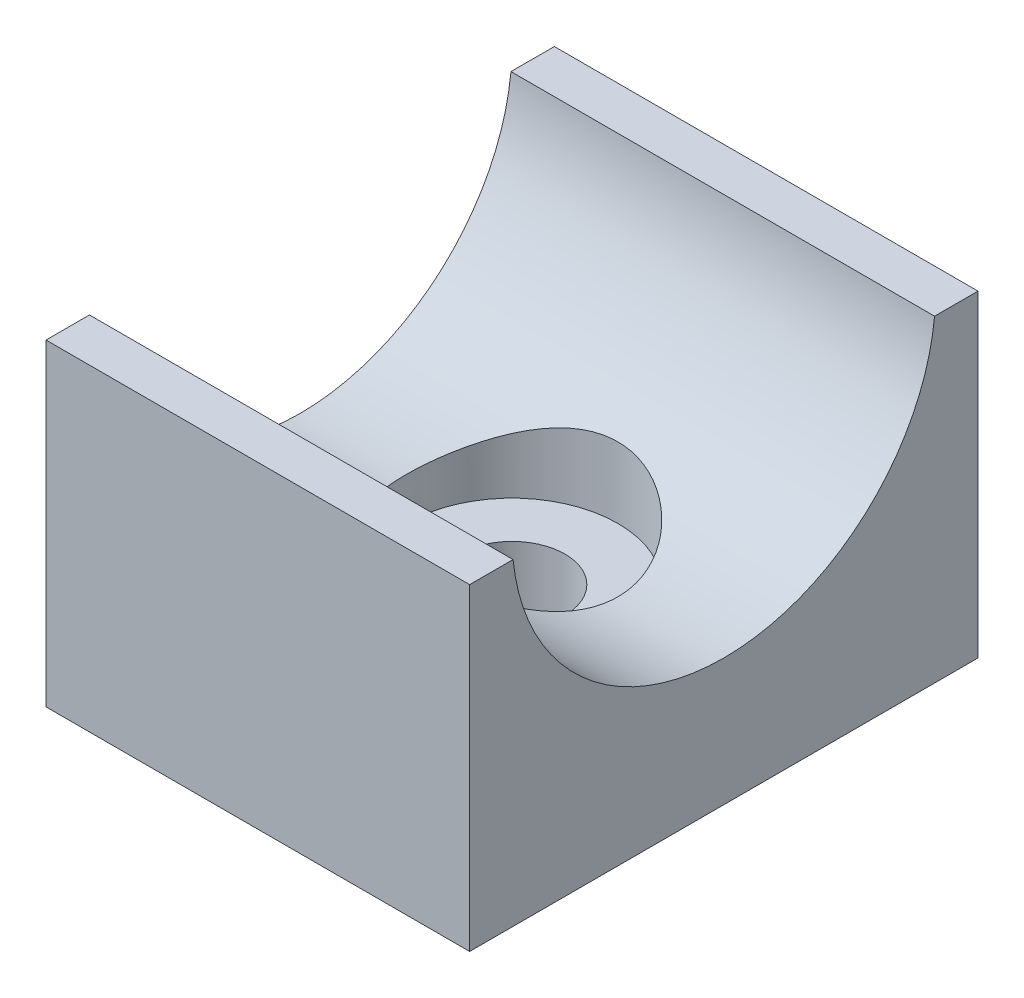
from build123d import *

# Parameters (mm, degrees)
BOSS_EXTRUDE1_DEPTH     = 25.4
CUT_EXTRUDE1_DEPTH      = 45.012417566
CUT_EXTRUDE1_DEPTH_BACK = 45.012417566
SKETCH2_R               = 3.175
SKETCH3_R               = 6.35
CUT_EXTRUDE3_DEPTH      = 13.97


with BuildPart() as part:
    # Sketch1 → Boss-Extrude1 (new body)
    with BuildSketch(Plane(origin=(0, 0, 0), x_dir=(0, 0, -1), z_dir=(1, 0, 0))):
        with BuildLine():
            Line((27.876340451, 19.05), (30.48, 19.05))
            Line((30.48, 19.05), (30.48, 0))
            Line((30.48, 0), (0, 0))
            Line((0, 0), (0, 19.05))
            Line((0, 19.05), (2.603659549, 19.05))
            ThreePointArc((2.603659549, 19.05), (15.24, 7.62), (27.876340451, 19.05))
        make_face()
    extrude(amount=BOSS_EXTRUDE1_DEPTH)

    # Sketch2 → Cut-Extrude1 (cut, two sides: drawn at the far end of the back side and taken through both)
    with BuildSketch(Plane.XZ.offset(-CUT_EXTRUDE1_DEPTH_BACK)):
        with Locations(Location((12.7, -15.24, 0), (0, 0, 270))):
            Circle(SKETCH2_R)
    extrude(amount=CUT_EXTRUDE1_DEPTH + CUT_EXTRUDE1_DEPTH_BACK, mode=Mode.SUBTRACT)

    # Sketch3 → Cut-Extrude3 (cut)
    with BuildSketch(Plane(origin=(0, 19.05, 0), x_dir=(1, 0, 0), z_dir=(0, 1, 0))):
        with Locations(Location((12.7, 15.24, 0), (0, 0, 270))):
            Circle(SKETCH3_R)
    extrude(amount=-CUT_EXTRUDE3_DEPTH, mode=Mode.SUBTRACT)


solid = part.part
